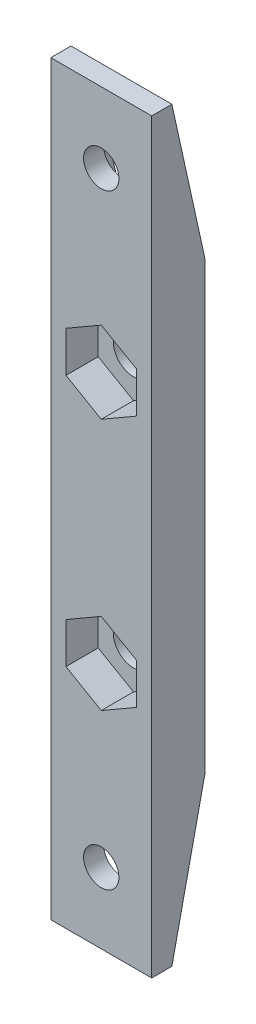
from build123d import *

# Parameters (mm, degrees)
SKETCH1_W           = 10
SKETCH1_H           = 50
BOSS_EXTRUDE1_DEPTH = 5.3
CUT_EXTRUDE1_DEPTH  = 3.2
SKETCH3_R           = 2
CUT_EXTRUDE2_DEPTH  = 8
SKETCH4_W           = 10
SKETCH4_H           = 5.3
BOSS_EXTRUDE2_DEPTH = 12
SKETCH5_W           = 10
SKETCH5_H           = 5.3
BOSS_EXTRUDE3_DEPTH = 12
CUT_EXTRUDE3_DEPTH  = 12
SKETCH8_W           = 6
SKETCH8_H           = 13
CUT_EXTRUDE4_DEPTH  = 3.3
SKETCH9_R           = 1.75
CUT_EXTRUDE5_DEPTH  = 3.3


with BuildPart() as part:
    # Sketch1 → Boss-Extrude1 (new body)
    with BuildSketch(Plane.XY):
        with Locations((5, 25)):
            Rectangle(SKETCH1_W, SKETCH1_H)
    extrude(amount=BOSS_EXTRUDE1_DEPTH)

    # Sketch2 → Cut-Extrude1 (cut)
    with BuildSketch(Plane.XY.offset(5.3)):
        Polygon((8.5, 14.520725942), (5, 16.541451884), (1.5, 14.520725942), (1.5, 10.479274058), (5, 8.458548116), (8.5, 10.479274058), align=None)
        Polygon((8.5, 39.520725942), (5, 41.541451884), (1.5, 39.520725942), (1.5, 35.479274058), (5, 33.458548116), (8.5, 35.479274058), align=None)
    extrude(amount=-CUT_EXTRUDE1_DEPTH, mode=Mode.SUBTRACT)

    # Sketch3 → Cut-Extrude2 (cut)
    with BuildSketch(Plane.XY.offset(2.1)):
        with Locations((5, 37.5)):
            Circle(SKETCH3_R)
        with Locations((5, 12.5)):
            Circle(SKETCH3_R)
    extrude(amount=-CUT_EXTRUDE2_DEPTH, mode=Mode.SUBTRACT)

    # Sketch4 → Boss-Extrude2 (add)
    with BuildSketch(Plane(origin=(0, 50, 0), x_dir=(1, 0, 0), z_dir=(0, 1, 0))):
        with Locations((5, -2.65)):
            Rectangle(SKETCH4_W, SKETCH4_H)
    extrude(amount=BOSS_EXTRUDE2_DEPTH)

    # Sketch5 → Boss-Extrude3 (add)
    with BuildSketch(Plane.XZ):
        with Locations((5, 2.65)):
            Rectangle(SKETCH5_W, SKETCH5_H)
    extrude(amount=BOSS_EXTRUDE3_DEPTH)

    # Sketch6 → Cut-Extrude3 (cut)
    with BuildSketch(Plane.ZY):
        Polygon((3.3, 62), (0, 47), (0, 62), align=None)
        Polygon((0, -12), (3.3, -12), (0, 3), align=None)
    extrude(amount=-CUT_EXTRUDE3_DEPTH, mode=Mode.SUBTRACT)

    # Sketch8 → Cut-Extrude4 (cut)
    with BuildSketch(Plane(origin=(0, 0, 0), x_dir=(-1, 0, 0), z_dir=(0, 0, -1))):
        with Locations((-5, 55.5)):
            Rectangle(SKETCH8_W, SKETCH8_H)
        with Locations((-5, -5.5)):
            Rectangle(SKETCH8_W, SKETCH8_H)
    extrude(amount=-CUT_EXTRUDE4_DEPTH, mode=Mode.SUBTRACT)

    # Sketch9 → Cut-Extrude5 (cut)
    with BuildSketch(Plane(origin=(0, 0, 3.3), x_dir=(-1, 0, 0), z_dir=(0, 0, -1))):
        with Locations((-5, -5)):
            Circle(SKETCH9_R)
        with Locations((-5, 55)):
            Circle(SKETCH9_R)
    extrude(amount=-CUT_EXTRUDE5_DEPTH, mode=Mode.SUBTRACT)


solid = part.part
